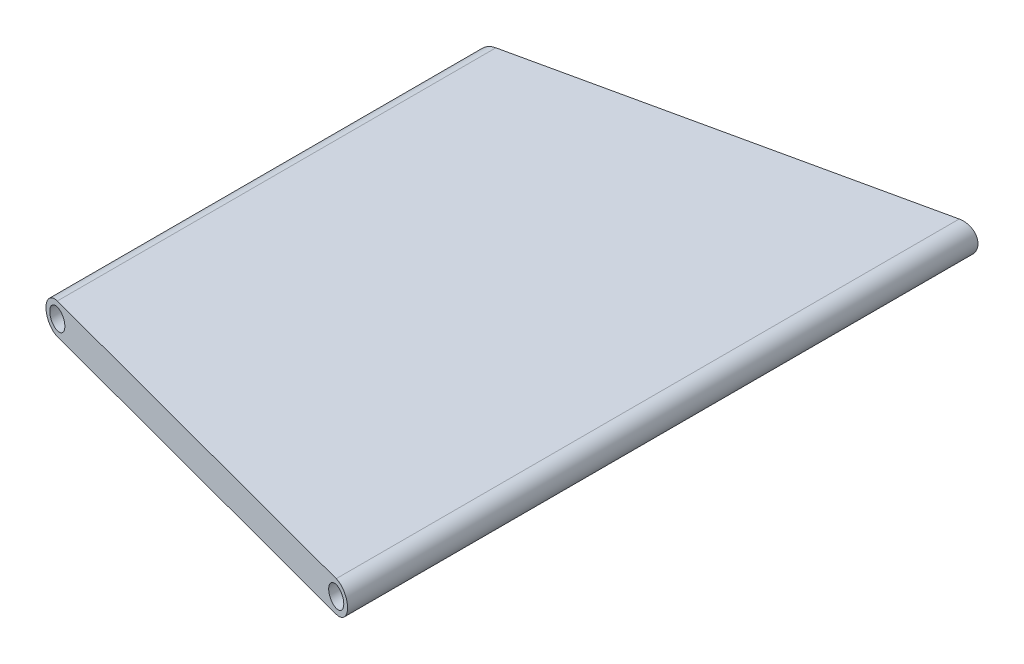
from build123d import *

# Parameters (mm, degrees)
BOSS_EXTRUDE1_DEPTH = 3
BOSS_EXTRUDE2_REACH = 76.759
SKETCH2_R           = 3
BOSS_EXTRUDE3_REACH = 79.18
SKETCH2_3_R         = 3
SKETCH2_3_R_2       = 2
SKETCH2_4_R         = 2
CUT_EXTRUDE1_DEPTH  = 103


with BuildPart() as part:
    # Sketch1 → Boss-Extrude1 (new, symmetric)
    with BuildSketch(Plane(origin=(0, 0, 0), x_dir=(1, 0, 0), z_dir=(0, 1, 0))):
        Polygon((-43.574876661, 44.4209239), (-43.574876661, -41), (30.425123339, -60.672481425), (30.425123339, 60.672481425), align=None)
    extrude(amount=BOSS_EXTRUDE1_DEPTH, both=True)

    # Boss-Extrude2: up to this plane
    boss_extrude2_end = Plane(origin=(-13.056453191, 3, 49.113150255), z_dir=(0.2569206163076567, 0, -0.9664325102748219))
    # Sketch2 → Boss-Extrude2 (add, up to the surface)
    with BuildSketch(Plane.XY, mode=Mode.PRIVATE) as boss_extrude2_sk1:
        with Locations((30.425123339, 0)):
            Circle(SKETCH2_R)
    boss_extrude2_tool1 = split(extrude(boss_extrude2_sk1.sketch, amount=BOSS_EXTRUDE2_REACH, mode=Mode.PRIVATE), bisect_by=boss_extrude2_end, keep=Keep.BOTH, mode=Mode.PRIVATE)
    add(boss_extrude2_tool1.solids().sort_by_distance((30.425123, 0, 0))[0])
    # Sketch2 → Boss-Extrude2 (add, up to the surface)
    with BuildSketch(Plane.XY, mode=Mode.PRIVATE) as boss_extrude2_sk2:
        with Locations((-43.574876661, 0)):
            Circle(SKETCH2_R)
    boss_extrude2_tool2 = split(extrude(boss_extrude2_sk2.sketch, amount=BOSS_EXTRUDE2_REACH, mode=Mode.PRIVATE), bisect_by=boss_extrude2_end, keep=Keep.BOTH, mode=Mode.PRIVATE)
    add(boss_extrude2_tool2.solids().sort_by_distance((-43.574877, 0, 0))[0])

    # Boss-Extrude3: up to this plane
    boss_extrude3_end = Plane(origin=(-11.311619848, 3, -51.506439766), z_dir=(-0.21450368815955828, 0, -0.9767231786775346))
    # Sketch2<3> → Boss-Extrude3 (add, up to the surface)
    with BuildSketch(Plane.XY, mode=Mode.PRIVATE) as boss_extrude3_sk1:
        with Locations((30.425123339, 0)):
            Circle(SKETCH2_3_R)
        with Locations((30.425123339, 0)):
            Circle(SKETCH2_3_R_2, mode=Mode.SUBTRACT)
    boss_extrude3_tool1 = split(extrude(boss_extrude3_sk1.sketch, amount=-BOSS_EXTRUDE3_REACH, mode=Mode.PRIVATE), bisect_by=boss_extrude3_end, keep=Keep.BOTH, mode=Mode.PRIVATE)
    add(boss_extrude3_tool1.solids().sort_by_distance((27.509976, 0, 0))[0])
    # Sketch2<3> → Boss-Extrude3 (add, up to the surface)
    with BuildSketch(Plane.XY, mode=Mode.PRIVATE) as boss_extrude3_sk2:
        with Locations((-43.574876661, 0)):
            Circle(SKETCH2_3_R)
        with Locations((-43.574876661, 0)):
            Circle(SKETCH2_3_R_2, mode=Mode.SUBTRACT)
    boss_extrude3_tool2 = split(extrude(boss_extrude3_sk2.sketch, amount=-BOSS_EXTRUDE3_REACH, mode=Mode.PRIVATE), bisect_by=boss_extrude3_end, keep=Keep.BOTH, mode=Mode.PRIVATE)
    add(boss_extrude3_tool2.solids().sort_by_distance((-46.490024, 0, 0))[0])

    # Sketch2<4> → Cut-Extrude1 (cut, symmetric)
    with BuildSketch(Plane.XY):
        with Locations((30.425123339, 0)):
            Circle(SKETCH2_4_R)
        with Locations((-43.574876661, 0)):
            Circle(SKETCH2_4_R)
    extrude(amount=CUT_EXTRUDE1_DEPTH, both=True, mode=Mode.SUBTRACT)


solid = part.part
